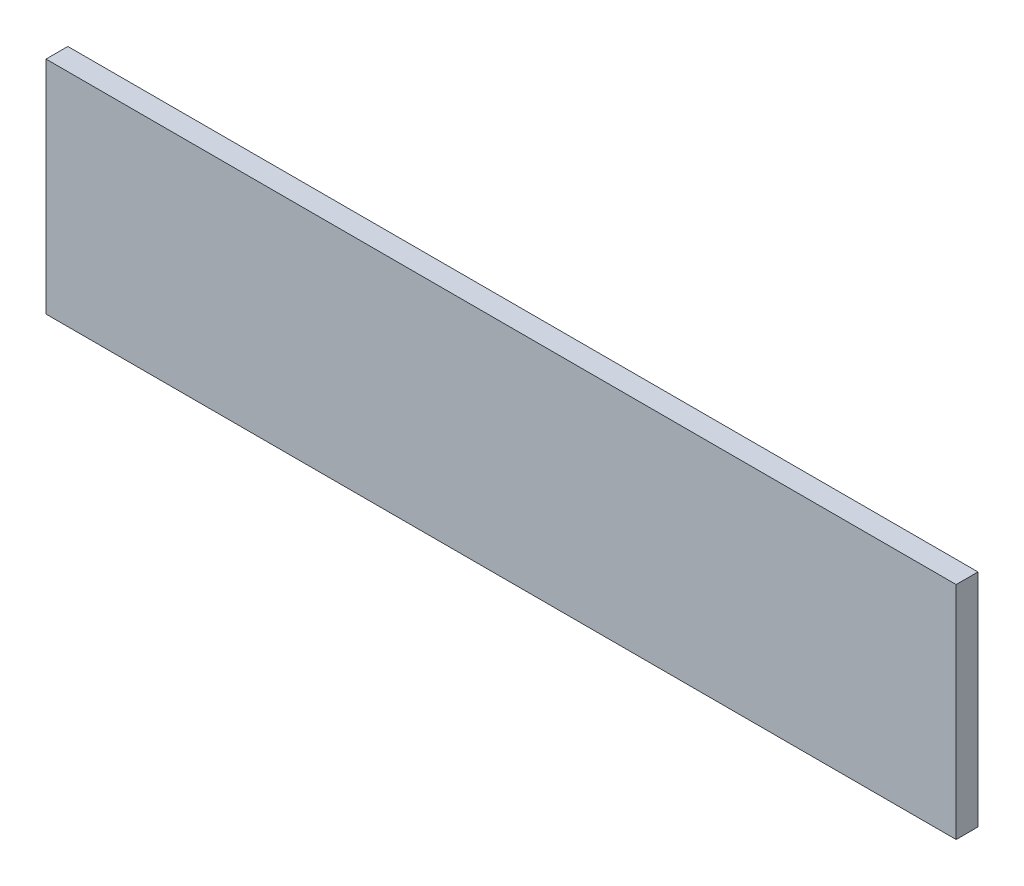
from build123d import *

# Parameters (mm, degrees)
SKETCH1_W           = 762
SKETCH1_H           = 184.912
BOSS_EXTRUDE1_DEPTH = 18.288


with BuildPart() as part:
    # Sketch1 → Boss-Extrude1 (new body)
    with BuildSketch(Plane.XY):
        with Locations((58.556886228, 141.77154491)):
            Rectangle(SKETCH1_W, SKETCH1_H)
    extrude(amount=BOSS_EXTRUDE1_DEPTH)


solid = part.part
